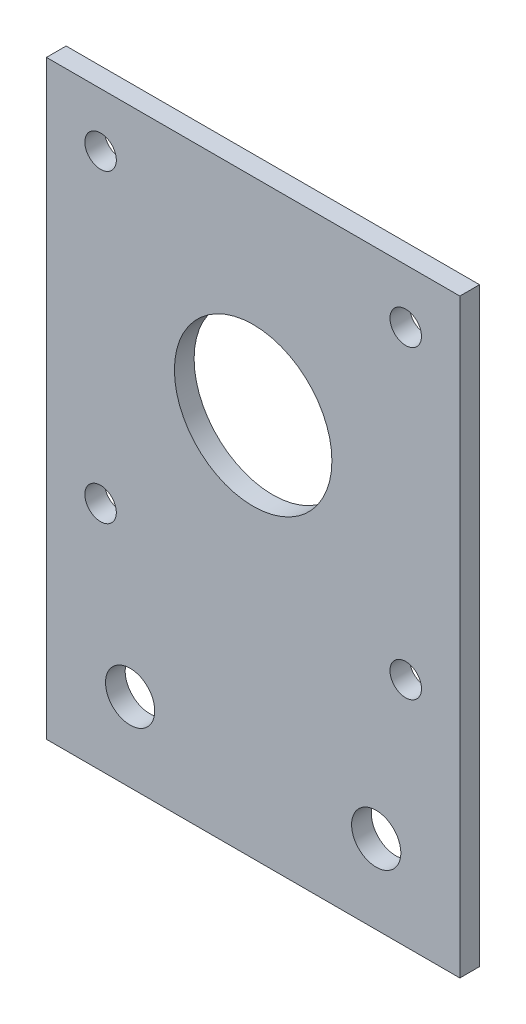
from build123d import *

# Parameters (mm, degrees)
SKETCH_1_W      = 42
SKETCH_1_H      = 60
SKETCH_1_R      = 8
SKETCH_1_R_2    = 1.6
SKETCH_1_R_3    = 2.5
EXTRUDE_1_DEPTH = 2


with BuildPart() as part:
    # 草图1 → 凸台-拉伸1 (new body)
    with BuildSketch(Plane.XY):
        with Locations((0, -9)):
            Rectangle(SKETCH_1_W, SKETCH_1_H)
        Circle(SKETCH_1_R, mode=Mode.SUBTRACT)
        with Locations((-15.5, 15.5)):
            Circle(SKETCH_1_R_2, mode=Mode.SUBTRACT)
        with Locations((-15.5, -15.5)):
            Circle(SKETCH_1_R_2, mode=Mode.SUBTRACT)
        with Locations((-12.5, -31)):
            Circle(SKETCH_1_R_3, mode=Mode.SUBTRACT)
        with Locations(Location((15.5, 15.5, 0), (0, 0, 180))):
            Circle(SKETCH_1_R_2, mode=Mode.SUBTRACT)
        with Locations(Location((15.5, -15.5, 0), (0, 0, 180))):
            Circle(SKETCH_1_R_2, mode=Mode.SUBTRACT)
        with Locations(Location((12.5, -31, 0), (0, 0, 180))):
            Circle(SKETCH_1_R_3, mode=Mode.SUBTRACT)
    extrude(amount=EXTRUDE_1_DEPTH)


solid = part.part
